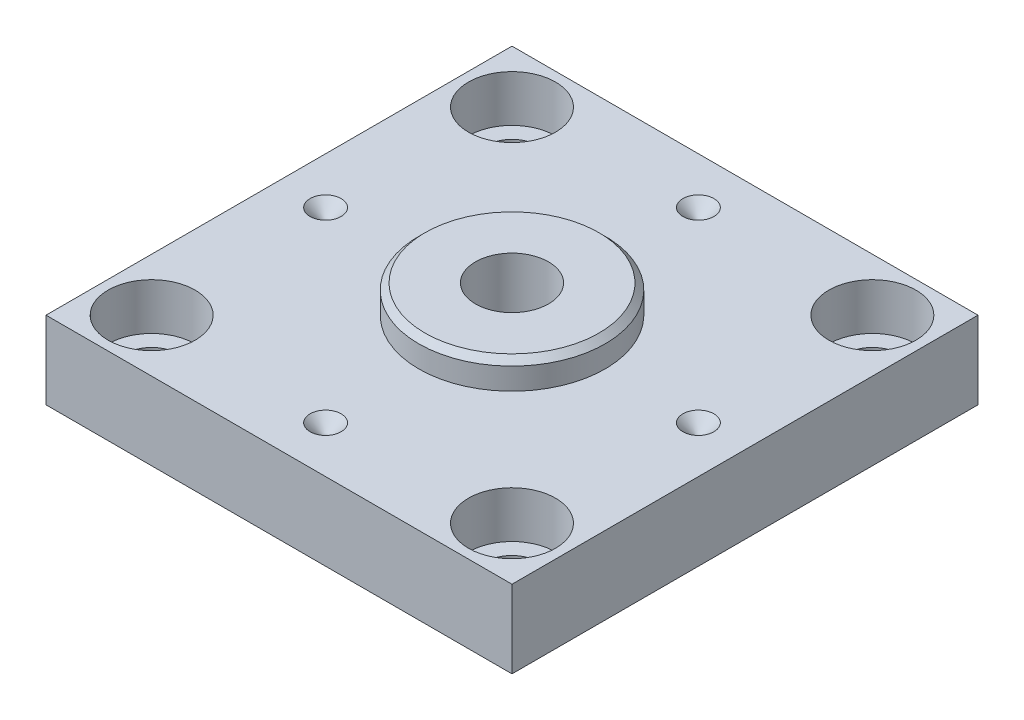
from build123d import *

# Parameters (mm, degrees)
SKETCH1_W              = 150
SKETCH1_H              = 150
BOSS_EXTRUDE1_DEPTH    = 25
SKETCH2_R              = 30
BOSS_EXTRUDE2_DEPTH    = 9
CHAMFER1_SIZE          = 2
M25X1_5_TAPPED_HOLE1_D = 23.5
HOLE1_D                = 17
HOLE1_CBORE_D          = 28
HOLE1_CBORE_DEPTH      = 15
CIRPATTERN1_COUNT      = 4


with BuildPart() as part:
    # Sketch1 → Boss-Extrude1 (new body)
    with BuildSketch(Plane(origin=(0, 0, 0), x_dir=(1, 0, 0), z_dir=(0, 1, 0))):
        Rectangle(SKETCH1_W, SKETCH1_H)
    extrude(amount=BOSS_EXTRUDE1_DEPTH)

    # Sketch2 → Boss-Extrude2 (add)
    with BuildSketch(Plane(origin=(0, 25, 0), x_dir=(1, 0, 0), z_dir=(0, 1, 0))):
        with Locations(Location((0, 0, 0), (0, 0, 270))):
            Circle(SKETCH2_R)
    extrude(amount=BOSS_EXTRUDE2_DEPTH)

    # Chamfer1
    chamfer1_edges = [part.edges().sort_by_distance(p)[0] for p in [
        (0, 34, -30),
    ]]
    chamfer(chamfer1_edges, length=CHAMFER1_SIZE)

    # M25x1.5 Tapped Hole1 (through all)
    with Locations(Plane(origin=(0, 34, 0), x_dir=(1, 0, 0), z_dir=(0, 1, 0))):
        with Locations((0, 0)):
            Hole(M25X1_5_TAPPED_HOLE1_D / 2)

    # Hole1 (through all)
    with Locations(Plane(origin=(0, 25, 0), x_dir=(1, 0, 0), z_dir=(0, 1, 0))):
        with Locations((-58, -58), (58, -58), (58, 58), (-58, 58)):
            CounterBoreHole(HOLE1_D / 2, HOLE1_CBORE_D / 2, HOLE1_CBORE_DEPTH)

    # Sketch7 → Cut-Revolve1 (revolve, cut)
    with BuildSketch(Plane.XY):
        Polygon((-65, 25), (-60, 20), (-60, 25), align=None)
    cut_revolve1 = revolve(axis=Axis((-60, 20, 0), (0, 1, 0)), mode=Mode.SUBTRACT)

    # CirPattern1: Cut-Revolve1 ×4 about axis
    cirpattern1_axis = Axis((0, 0, 0), (0, 1, 0))
    for i in range(1, CIRPATTERN1_COUNT):
        add(cut_revolve1.rotate(cirpattern1_axis, i * 360 / CIRPATTERN1_COUNT), mode=Mode.SUBTRACT)


solid = part.part
